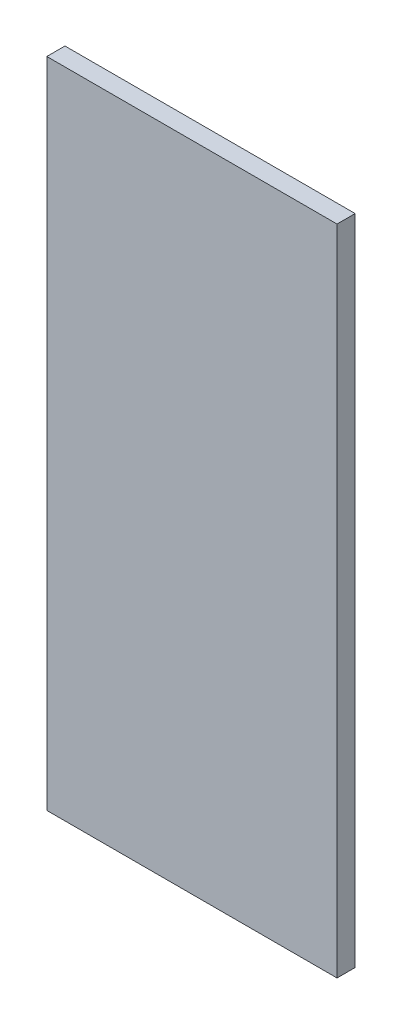
from build123d import *

# Parameters (mm, degrees)
SKETCH1_W           = 50.8
SKETCH1_H           = 114.3
BOSS_EXTRUDE1_DEPTH = 3.175


with BuildPart() as part:
    # Sketch1 → Boss-Extrude1 (new body)
    with BuildSketch(Plane.XY):
        with Locations((25.4, 57.15)):
            Rectangle(SKETCH1_W, SKETCH1_H)
    extrude(amount=BOSS_EXTRUDE1_DEPTH)


solid = part.part
